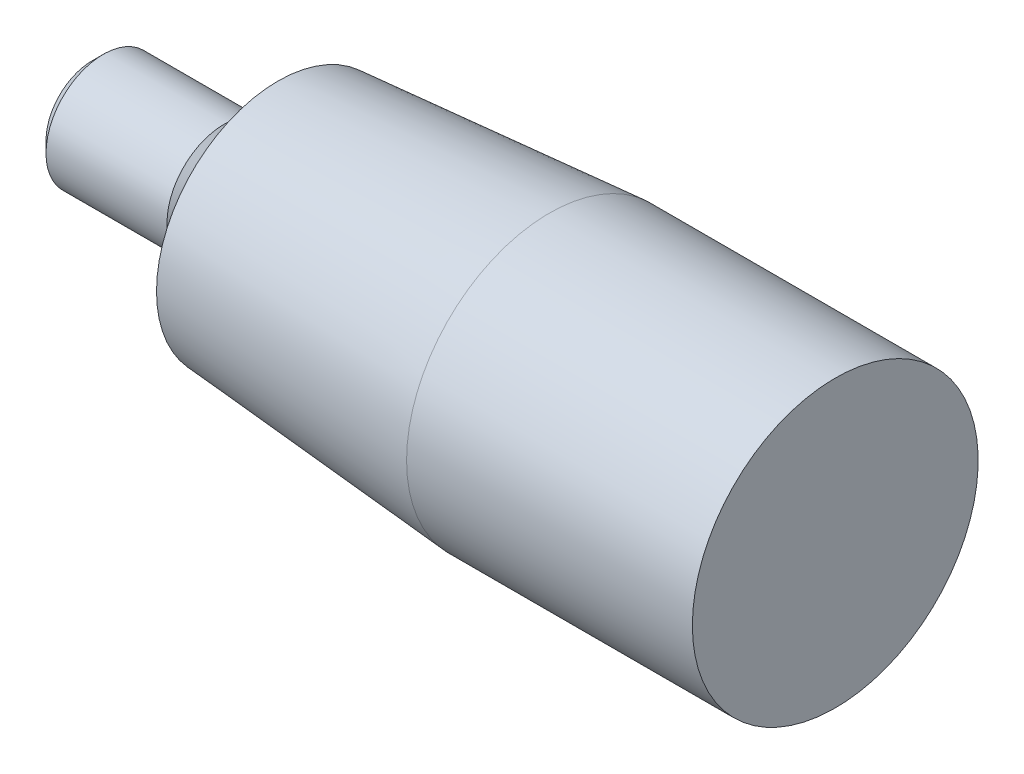
from build123d import *

# Parameters (mm, degrees)
CUT_EXTRUDE_1_DEPTH = 4


with BuildPart() as part:
    # 草图1 → 旋转1 (revolve)
    with BuildSketch(Plane.XY):
        Polygon((-13, 0), (-13, 3.233), (-12.233, 4), (-3.767, 4), (-3.0905, 3.3235), (-1, 3.3235), (-1, 5), (0, 5), (0, 8.5), (19, 10), (39, 10), (39, 0), align=None)
    revolve(axis=Axis((39, 0, 0), (-1, 0, 0)))

    # 草图2 → 切除-拉伸1 (cut)
    with BuildSketch(Plane(origin=(-13, 0, 0), x_dir=(0, 0, -1), z_dir=(1, 0, 0))):
        Polygon((-2, 1.154700538), (-2, -1.154700538), (0, -2.309401077), (2, -1.154700538), (2, 1.154700538), (0, 2.309401077), align=None)
    extrude(amount=CUT_EXTRUDE_1_DEPTH, mode=Mode.SUBTRACT)

    # 草图3 → 切除-旋转1 (revolve, cut)
    with BuildSketch(Plane.XY):
        Polygon((-9, 0), (-9, 2.309401077), (-7.67, 0), align=None)
    revolve(axis=Axis((-7.67, 0, 0), (-1, 0, 0)), mode=Mode.SUBTRACT)


solid = part.part
